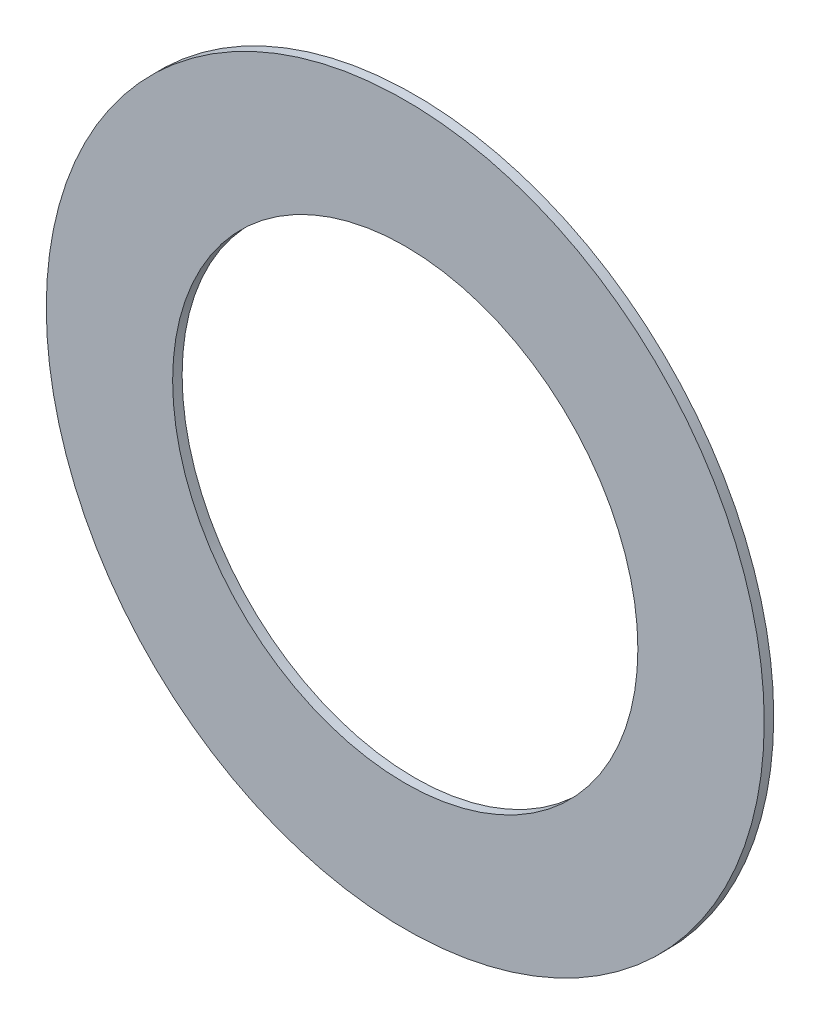
from build123d import *

# Parameters (mm, degrees)
SKETCH1_R           = 7.9375
SKETCH1_R_2         = 5.1435
BOSS_EXTRUDE1_DEPTH = 0.21


with BuildPart() as part:
    # Sketch1 → Boss-Extrude1 (new body)
    with BuildSketch(Plane.XY):
        Circle(SKETCH1_R)
        Circle(SKETCH1_R_2, mode=Mode.SUBTRACT)
    extrude(amount=BOSS_EXTRUDE1_DEPTH)


solid = part.part
